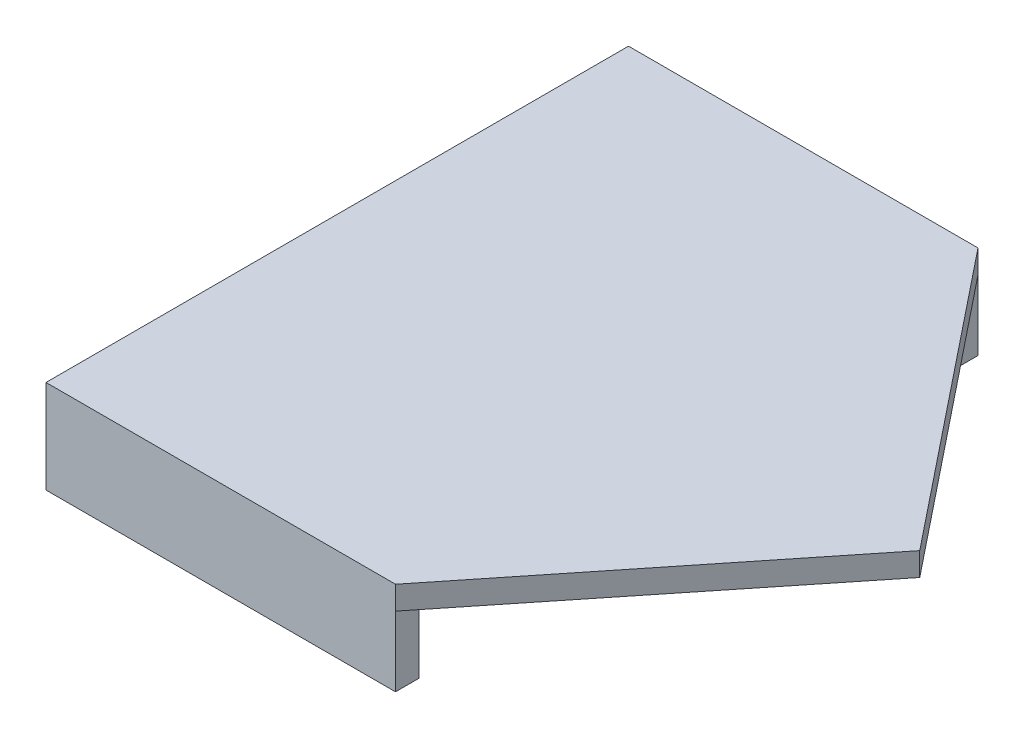
from build123d import *

# Parameters (mm, degrees)
BOSS_EXTRUDE1_DEPTH = 5
SKETCH2_W           = 150
SKETCH2_H           = 30
BOSS_EXTRUDE2_DEPTH = 10


with BuildPart() as part:
    # Sketch1 → Boss-Extrude1 (new, symmetric)
    with BuildSketch(Plane(origin=(0, 0, 0), x_dir=(1, 0, 0), z_dir=(0, 1, 0))):
        Polygon((75, 125), (175, 0), (75, -125), (-75, -125), (-75, 125), align=None)
    extrude(amount=BOSS_EXTRUDE1_DEPTH, both=True)

    # Sketch2 → Boss-Extrude2 (add)
    with BuildSketch(Plane(origin=(0, 0, -125), x_dir=(-1, 0, 0), z_dir=(0, 0, -1))):
        with Locations((0, -20)):
            Rectangle(SKETCH2_W, SKETCH2_H)
    boss_extrude2 = extrude(amount=-BOSS_EXTRUDE2_DEPTH)

    # Mirror1: Boss-Extrude2 across plane
    add(boss_extrude2.mirror(Plane.XY))


solid = part.part
